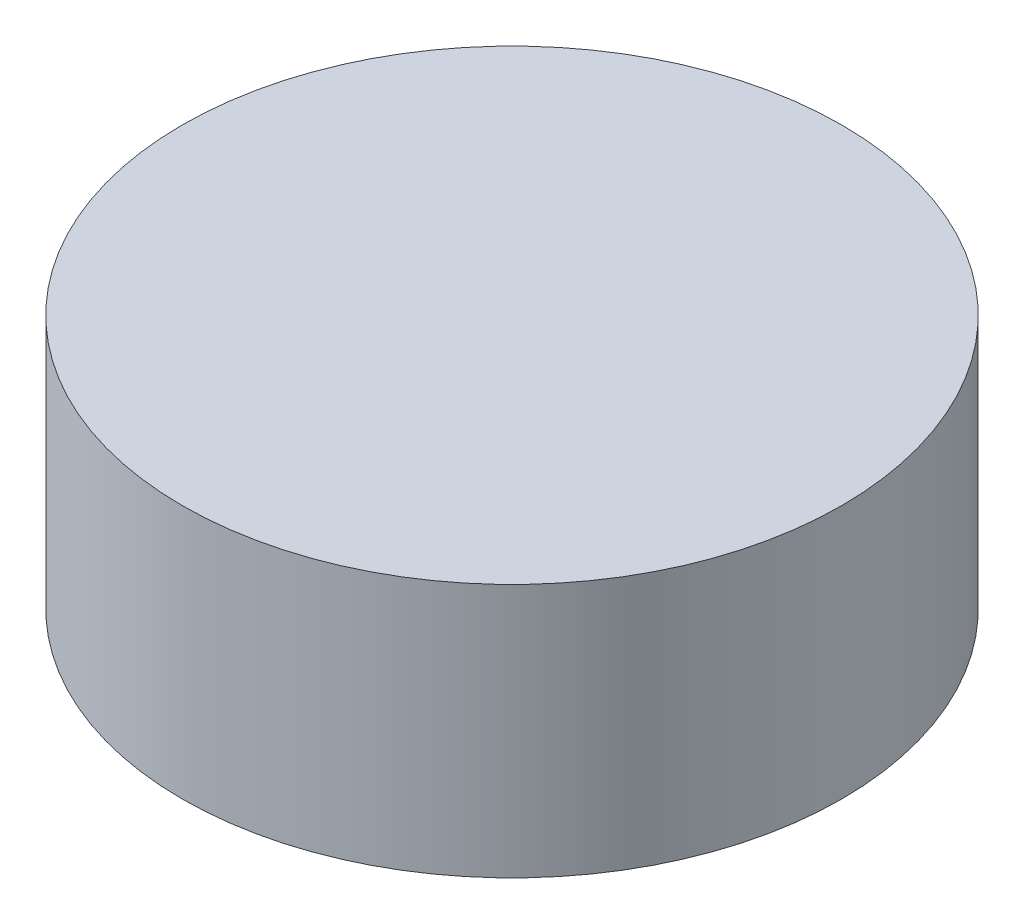
from build123d import *

# Parameters (mm, degrees)
SKETCH1_R           = 6.475000004
BOSS_EXTRUDE1_DEPTH = 4.9911


with BuildPart() as part:
    # Sketch1 → Boss-Extrude1 (new body)
    with BuildSketch(Plane(origin=(0, 0, 0), x_dir=(1, 0, 0), z_dir=(0, 1, 0))):
        with Locations(Location((0, 0, 0), (0, 0, 90))):
            Circle(SKETCH1_R)
    extrude(amount=BOSS_EXTRUDE1_DEPTH)


solid = part.part
